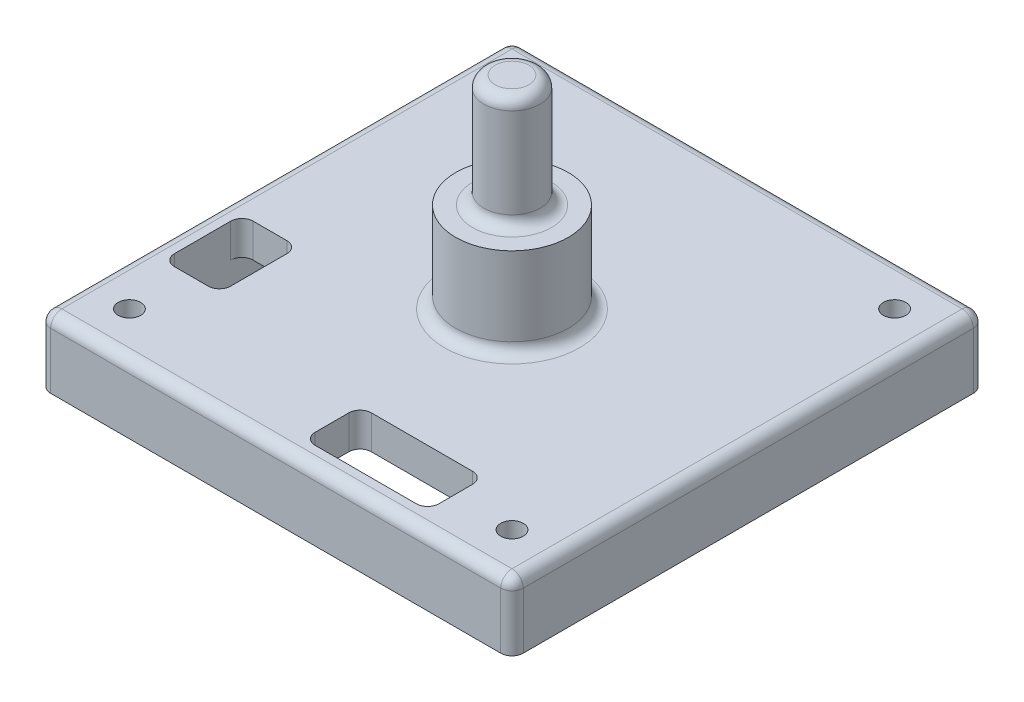
from build123d import *

# Parameters (mm, degrees)
SKETCH1_W           = 42
SKETCH1_H           = 42
BOSS_EXTRUDE1_DEPTH = 6
SKETCH2_W           = 38.5
SKETCH2_H           = 38.5
CUT_EXTRUDE1_DEPTH  = 3
CUT_EXTRUDE2_REACH  = 31.85
SKETCH3_W           = 5
SKETCH3_H           = 7
SKETCH3_W_2         = 11
SKETCH3_H_2         = 5
BOSS_EXTRUDE2_DEPTH = 1.5
SKETCH5_R           = 1
CUT_EXTRUDE3_DEPTH  = 31.037476592
SKETCH6_R           = 5
BOSS_EXTRUDE3_DEPTH = 8
SKETCH7_R           = 2.5
BOSS_EXTRUDE4_DEPTH = 10
FILLET1_R           = 1


with BuildPart() as part:
    # Sketch1 → Boss-Extrude1 (new body)
    with BuildSketch(Plane(origin=(0, 0, 0), x_dir=(1, 0, 0), z_dir=(0, 1, 0))):
        Rectangle(SKETCH1_W, SKETCH1_H)
    extrude(amount=BOSS_EXTRUDE1_DEPTH)

    # Sketch2 → Cut-Extrude1 (cut)
    with BuildSketch(Plane.XZ):
        Rectangle(SKETCH2_W, SKETCH2_H)
    extrude(amount=-CUT_EXTRUDE1_DEPTH, mode=Mode.SUBTRACT)

    # Sketch3 → Cut-Extrude2 (cut, up to next)
    with BuildSketch(Plane.XZ.offset(-3), mode=Mode.PRIVATE) as cut_extrude2_sk1:
        with Locations((-16.75, 8.25)):
            Rectangle(SKETCH3_W, SKETCH3_H)
    cut_extrude2_tool1 = extrude(cut_extrude2_sk1.sketch, amount=-CUT_EXTRUDE2_REACH, mode=Mode.PRIVATE) & part.part
    # Sketch3 → Cut-Extrude2 (cut, up to next)
    with BuildSketch(Plane.XZ.offset(-3), mode=Mode.PRIVATE) as cut_extrude2_sk2:
        with Locations((6.25, 16.75)):
            Rectangle(SKETCH3_W_2, SKETCH3_H_2)
    cut_extrude2_tool2 = extrude(cut_extrude2_sk2.sketch, amount=-CUT_EXTRUDE2_REACH, mode=Mode.PRIVATE) & part.part
    add(cut_extrude2_tool1.solids().sort_by_distance((-16.75, 3, 8.25))[0], mode=Mode.SUBTRACT)
    add(cut_extrude2_tool2.solids().sort_by_distance((6.25, 3, 16.75))[0], mode=Mode.SUBTRACT)

    # Sketch4 → Boss-Extrude2 (add)
    with BuildSketch(Plane.XZ.offset(-3)):
        with BuildLine():
            Line((-19.25, 15.910275264), (-19.25, 19.25))
            Line((-19.25, 19.25), (-15.910275264, 19.25))
            ThreePointArc((-15.910275264, 19.25), (-15.232233047, 15.232233047), (-19.25, 15.910275264))
        make_face()
        with BuildLine():
            Line((19.25, 19.25), (15.910275264, 19.25))
            ThreePointArc((15.910275264, 19.25), (15.232233047, 15.232233047), (19.25, 15.910275264))
            Line((19.25, 15.910275264), (19.25, 19.25))
        make_face()
        with BuildLine():
            Line((-19.25, -19.25), (-15.910275264, -19.25))
            ThreePointArc((-15.910275264, -19.25), (-15.232233047, -15.232233047), (-19.25, -15.910275264))
            Line((-19.25, -15.910275264), (-19.25, -19.25))
        make_face()
        with BuildLine():
            Line((19.25, -15.910275264), (19.25, -19.25))
            Line((19.25, -19.25), (15.910275264, -19.25))
            ThreePointArc((15.910275264, -19.25), (15.232233047, -15.232233047), (19.25, -15.910275264))
        make_face()
    extrude(amount=BOSS_EXTRUDE2_DEPTH)

    # Sketch5 → Cut-Extrude3 (cut, through all)
    with BuildSketch(Plane.XZ.offset(-1.5)):
        with Locations(Location((-17, 17, 0), (0, 0, 270))):
            Circle(SKETCH5_R)
        with Locations(Location((17, 17, 0), (0, 0, 270))):
            Circle(SKETCH5_R)
        with Locations(Location((17, -17, 0), (0, 0, 270))):
            Circle(SKETCH5_R)
        with Locations(Location((-17, -17, 0), (0, 0, 270))):
            Circle(SKETCH5_R)
    extrude(amount=-CUT_EXTRUDE3_DEPTH, mode=Mode.SUBTRACT)

    # Sketch6 → Boss-Extrude3 (add)
    with BuildSketch(Plane(origin=(0, 6, 0), x_dir=(1, 0, 0), z_dir=(0, 1, 0))):
        with Locations(Location((0, 0, 0), (0, 0, 270))):
            Circle(SKETCH6_R)
    extrude(amount=BOSS_EXTRUDE3_DEPTH)

    # Sketch7 → Boss-Extrude4 (add)
    with BuildSketch(Plane(origin=(0, 14, 0), x_dir=(1, 0, 0), z_dir=(0, 1, 0))):
        with Locations(Location((0, 0, 0), (0, 0, 270))):
            Circle(SKETCH7_R)
    extrude(amount=BOSS_EXTRUDE4_DEPTH)

    # Fillet1
    fillet1_edges = [part.edges().sort_by_distance(p)[0] for p in [
        (0, 6, -5),
        (0, 14, -2.5),
        (0, 24, -2.5),
        (-21, 6, 0),
        (0, 6, 21),
        (-14.25, 4.5, 11.75),
        (-14.25, 4.5, 4.75),
        (-19.25, 4.5, 4.75),
        (-19.25, 4.5, 11.75),
        (11.75, 4.5, 19.25),
        (11.75, 4.5, 14.25),
        (0.75, 4.5, 14.25),
        (0.75, 4.5, 19.25),
        (21, 6, 0),
        (21, 3, 21),
        (-21, 3, 21),
        (-21, 3, -21),
        (21, 3, -21),
        (0, 6, -21),
    ]]
    fillet(fillet1_edges, radius=FILLET1_R)


solid = part.part
